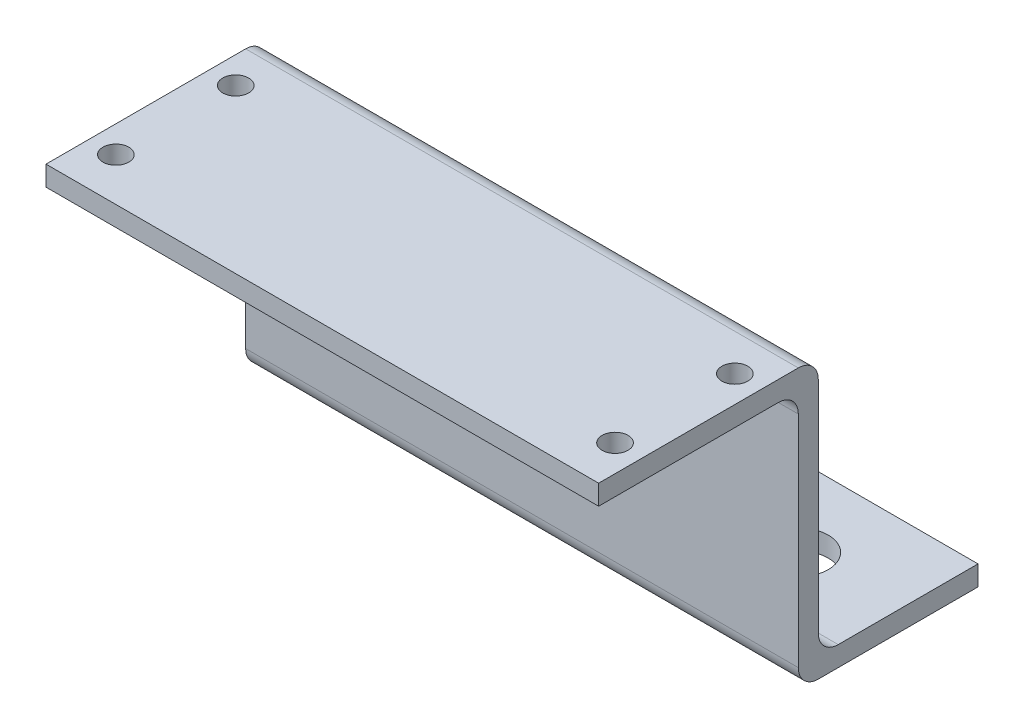
from build123d import *

# Parameters (mm, degrees)
SKETCH_1_R          = 3
EXTRUDE_1_DEPTH     = 2
SKETCH_2_R          = 4
SKETCH_2_W          = 27.67766953
SKETCH_2_H          = 2
EXTRUDE_2_DEPTH     = 2
EXTRUDE_START       = 2
SKETCH_3_W          = 55.35533906
SKETCH_3_H          = 26
SKETCH_3_R          = 4
EXTRUDE_3_DEPTH     = 2
SKETCH_4_W          = 55.35533906
SKETCH_4_H          = 24
CUT_EXTRUDE_1_DEPTH = 2
FILLET_1_R          = 2
SKETCH_5_W          = 55.35533906
SKETCH_5_H          = 2
EXTRUDE_4_DEPTH     = 22
SKETCH_6_R          = 1.3
CUT_EXTRUDE_2_DEPTH = 22
FILLET_2_R          = 2
FILLET_3_R          = 2
FILLET_4_R          = 2


with BuildPart() as part:
    # 草图1 → 凸台-拉伸1 (new body)
    with BuildSketch(Plane(origin=(0, 0, 0), x_dir=(1, 0, 0), z_dir=(0, 1, 0))):
        Polygon((-17.67766953, 9.67766953), (-27.67766953, 9.67766953), (-27.67766953, 25.67766953), (17.67766953, 25.67766953), (27.67766953, 25.67766953), (27.67766953, 9.67766953), align=None)
        with Locations(Location((-17.67766953, 17.67766953, 0), (0, 0, 270))):
            Circle(SKETCH_1_R, mode=Mode.SUBTRACT)
        with Locations(Location((17.67766953, 17.67766953, 0), (0, 0, 270))):
            Circle(SKETCH_1_R, mode=Mode.SUBTRACT)
    extrude(amount=EXTRUDE_1_DEPTH)

    # 草图2 → 凸台-拉伸2 (add)
    # profile 1 of 3: a face of its own
    with BuildSketch(Plane.XY.offset(-9.67766953)):
        Polygon((-27.67766953, 26), (-27.67766953, 2), (0, 2), (27.67766953, 2), (27.67766953, 26), align=None)
        with Locations((-9, 14)):
            Circle(SKETCH_2_R, mode=Mode.SUBTRACT)
        with Locations((9, 14)):
            Circle(SKETCH_2_R, mode=Mode.SUBTRACT)
    # profile 2 of 3: a face of its own
    with BuildSketch(Plane.XY.offset(-9.67766953)):
        with Locations((-13.838834765, 1)):
            Rectangle(SKETCH_2_W, SKETCH_2_H)
    # profile 3 of 3: a face of its own
    with BuildSketch(Plane.XY.offset(-9.67766953)):
        with Locations((13.838834765, 1)):
            Rectangle(SKETCH_2_W, SKETCH_2_H)
    extrude(amount=-EXTRUDE_2_DEPTH)

    # 草图3 → 凸台-拉伸3 (add)
    with BuildSketch(Plane.XY.offset(-9.67766953).offset(EXTRUDE_START)):
        with Locations((0, 13)):
            Rectangle(SKETCH_3_W, SKETCH_3_H)
        with Locations((-9, 14)):
            Circle(SKETCH_3_R, mode=Mode.SUBTRACT)
        with Locations((9, 14)):
            Circle(SKETCH_3_R, mode=Mode.SUBTRACT)
    extrude(amount=-EXTRUDE_3_DEPTH)

    # 草图4 → 切除-拉伸1 (cut)
    with BuildSketch(Plane.XY.offset(-9.67766953)):
        with Locations((0, 14)):
            Rectangle(SKETCH_4_W, SKETCH_4_H)
    extrude(amount=-CUT_EXTRUDE_1_DEPTH, mode=Mode.SUBTRACT)

    # 圆角1
    fillet_1_edges = [part.edges().sort_by_distance(p)[0] for p in [
        (0, 0, -7.67766953),
    ]]
    fillet(fillet_1_edges, radius=FILLET_1_R)

    # 草图5 → 凸台-拉伸4 (add)
    with BuildSketch(Plane(origin=(0, 0, -9.67766953), x_dir=(-1, 0, 0), z_dir=(0, 0, -1))):
        with Locations((0, 27)):
            Rectangle(SKETCH_5_W, SKETCH_5_H)
    extrude(amount=-EXTRUDE_4_DEPTH)

    # 草图6 → 切除-拉伸2 (cut)
    with BuildSketch(Plane(origin=(0, 28, 0), x_dir=(1, 0, 0), z_dir=(0, 1, 0))):
        with Locations(Location((25, -8, 0), (0, 0, 270))):
            Circle(SKETCH_6_R)
        with Locations(Location((25, 4, 0), (0, 0, 270))):
            Circle(SKETCH_6_R)
        with Locations(Location((-25, 4, 0), (0, 0, 90))):
            Circle(SKETCH_6_R)
        with Locations(Location((-25, -8, 0), (0, 0, 90))):
            Circle(SKETCH_6_R)
    extrude(amount=-CUT_EXTRUDE_2_DEPTH, mode=Mode.SUBTRACT)

    # 圆角2
    fillet_2_edges = [part.edges().sort_by_distance(p)[0] for p in [
        (0, 28, -9.67766953),
    ]]
    fillet(fillet_2_edges, radius=FILLET_2_R)

    # 圆角3
    fillet_3_edges = [part.edges().sort_by_distance(p)[0] for p in [
        (0, 26, -7.67766953),
    ]]
    fillet(fillet_3_edges, radius=FILLET_3_R)

    # 圆角4
    fillet_4_edges = [part.edges().sort_by_distance(p)[0] for p in [
        (0, 2, -9.67766953),
    ]]
    fillet(fillet_4_edges, radius=FILLET_4_R)


solid = part.part
